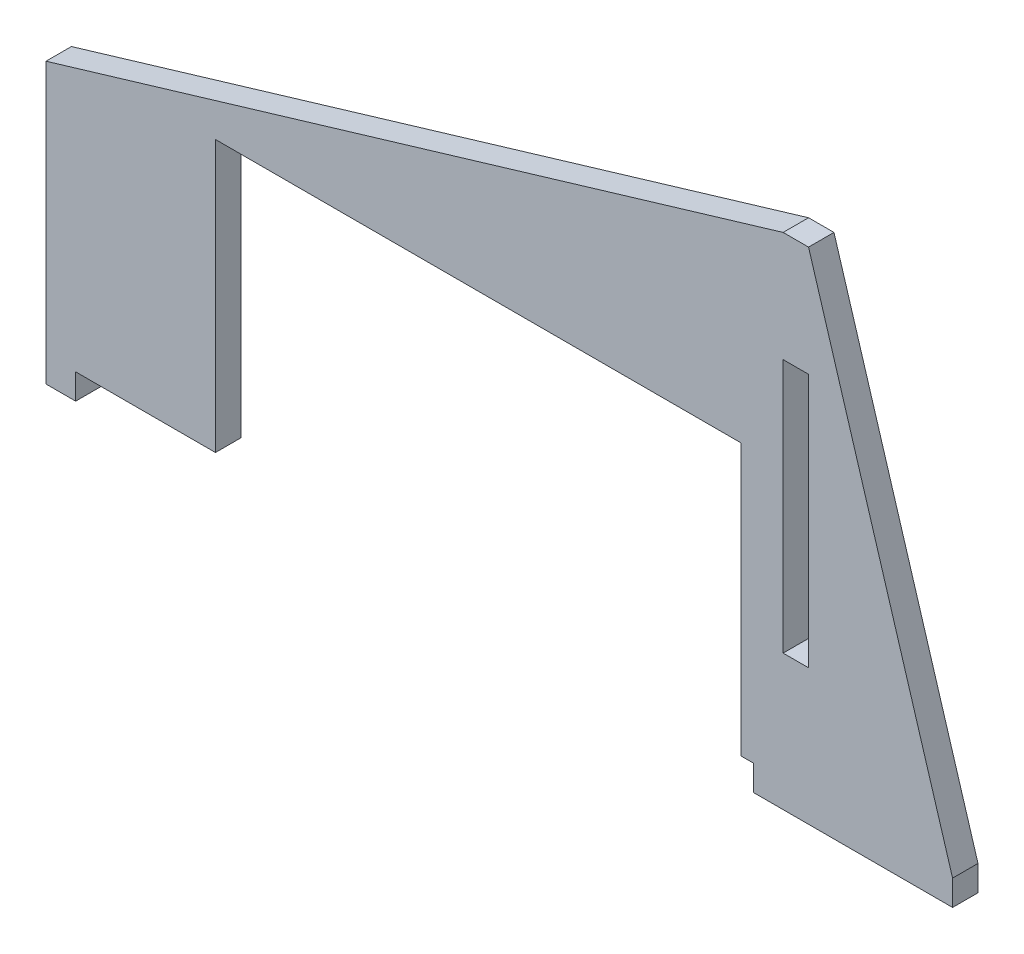
from build123d import *

# Parameters (mm, degrees)
SKETCH1_W           = 3
SKETCH1_H           = 30
BOSS_EXTRUDE1_DEPTH = 3


with BuildPart() as part:
    # Sketch1 → Boss-Extrude1 (new body)
    with BuildSketch(Plane.XY):
        Polygon((-90, 0), (-86.5, 0), (-86.5, 3), (-70, 3), (-70, 35), (-8, 35), (-8, 3), (-6.5, 3), (-6.5, 0), (17, 0), (17, 3), (0, 59), (-3, 59), (-90, 33), align=None)
        with Locations((-1.5, 31)):
            Rectangle(SKETCH1_W, SKETCH1_H, mode=Mode.SUBTRACT)
    extrude(amount=BOSS_EXTRUDE1_DEPTH)


solid = part.part
